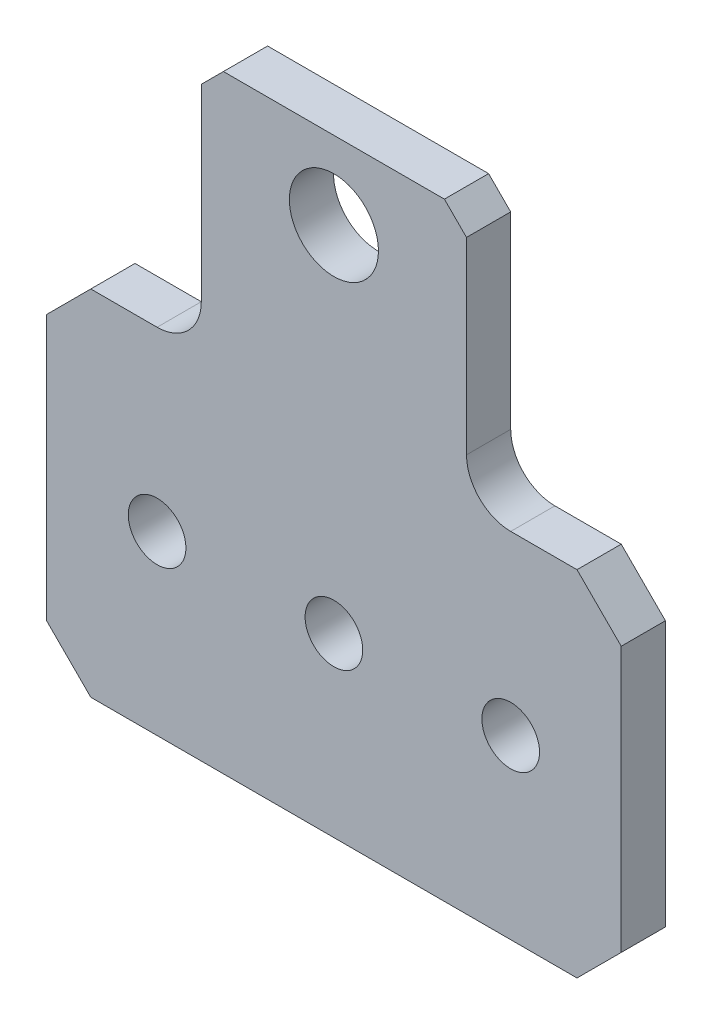
from build123d import *

# Parameters (mm, degrees)
SKETCH1_R           = 3.2004
SKETCH1_R_2         = 2.0701
BOSS_EXTRUDE1_DEPTH = 3.175
SKETCH2_W           = 93.151667475
SKETCH2_H           = 52.927195285
CUT_EXTRUDE1_DEPTH  = 46.916296315


with BuildPart() as part:
    # Sketch1 → Boss-Extrude1 (new body)
    with BuildSketch(Plane(origin=(0, 0, 0), x_dir=(-1, 0, 0), z_dir=(0, 0, -1))):
        with BuildLine():
            Line((-17.4625, -15.494), (-20.6375, -18.669))
            Line((-20.6375, -18.669), (-20.6375, -37.719))
            Line((-20.6375, -37.719), (-17.4625, -40.894))
            Line((-17.4625, -40.894), (17.4625, -40.894))
            Line((17.4625, -40.894), (20.6375, -37.719))
            Line((20.6375, -37.719), (20.6375, -18.669))
            Line((20.6375, -18.669), (17.4625, -15.494))
            Line((17.4625, -15.494), (12.7, -15.494))
            ThreePointArc((12.7, -15.494), (10.45493597, -14.56406403), (9.525, -12.319))
            Line((9.525, -12.319), (9.525, 1.2065))
            Line((9.525, 1.2065), (7.9375, 2.794))
            Line((7.9375, 2.794), (9.525, 4.3815))
            Line((9.525, 4.3815), (9.525, 37.719))
            Line((9.525, 37.719), (6.35, 40.894))
            Line((6.35, 40.894), (-6.35, 40.894))
            Line((-6.35, 40.894), (-9.525, 37.719))
            Line((-9.525, 37.719), (-9.525, 4.3815))
            Line((-9.525, 4.3815), (-7.9375, 2.794))
            Line((-7.9375, 2.794), (-9.525, 1.2065))
            Line((-9.525, 1.2065), (-9.525, -12.319))
            ThreePointArc((-9.525, -12.319), (-10.45493597, -14.56406403), (-12.7, -15.494))
            Line((-12.7, -15.494), (-17.4625, -15.494))
        make_face()
        with Locations(Location((0, 35.306, 0), (0, 0, 180))):
            Circle(SKETCH1_R, mode=Mode.SUBTRACT)
        with Locations(Location((0, -2.794, 0), (0, 0, 180))):
            Circle(SKETCH1_R, mode=Mode.SUBTRACT)
        with Locations(Location((12.7, -28.194, 0), (0, 0, 180))):
            Circle(SKETCH1_R_2, mode=Mode.SUBTRACT)
        with Locations(Location((-12.7, -28.194, 0), (0, 0, 180))):
            Circle(SKETCH1_R_2, mode=Mode.SUBTRACT)
        with Locations(Location((0, -28.194, 0), (0, 0, 180))):
            Circle(SKETCH1_R_2, mode=Mode.SUBTRACT)
    extrude(amount=-BOSS_EXTRUDE1_DEPTH)

    # Sketch2 → Cut-Extrude1 (cut, through all)
    with BuildSketch(Plane.XY):
        with Locations((-4.603686966, 29.257597642)):
            Rectangle(SKETCH2_W, SKETCH2_H)
    extrude(amount=CUT_EXTRUDE1_DEPTH, mode=Mode.SUBTRACT)


solid = part.part
